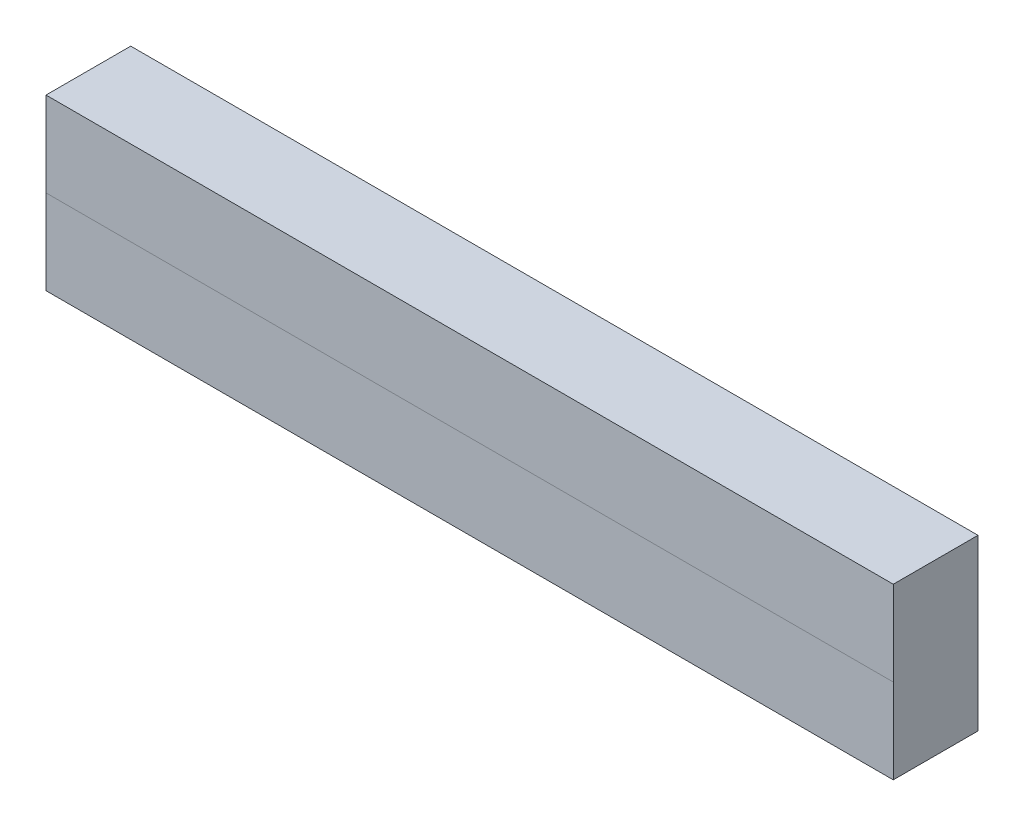
from build123d import *

# Parameters (mm, degrees)
SKETCH_1_W      = 10
SKETCH_1_H      = 20
EXTRUDE_1_DEPTH = 100


with BuildPart() as part:
    # Эскиз1 → Бобышка-Вытянуть1 (new body)
    with BuildSketch(Plane(origin=(0, 0, 0), x_dir=(0, 0, -1), z_dir=(1, 0, 0))):
        Rectangle(SKETCH_1_W, SKETCH_1_H)
    extrude(amount=EXTRUDE_1_DEPTH)


solid = part.part
